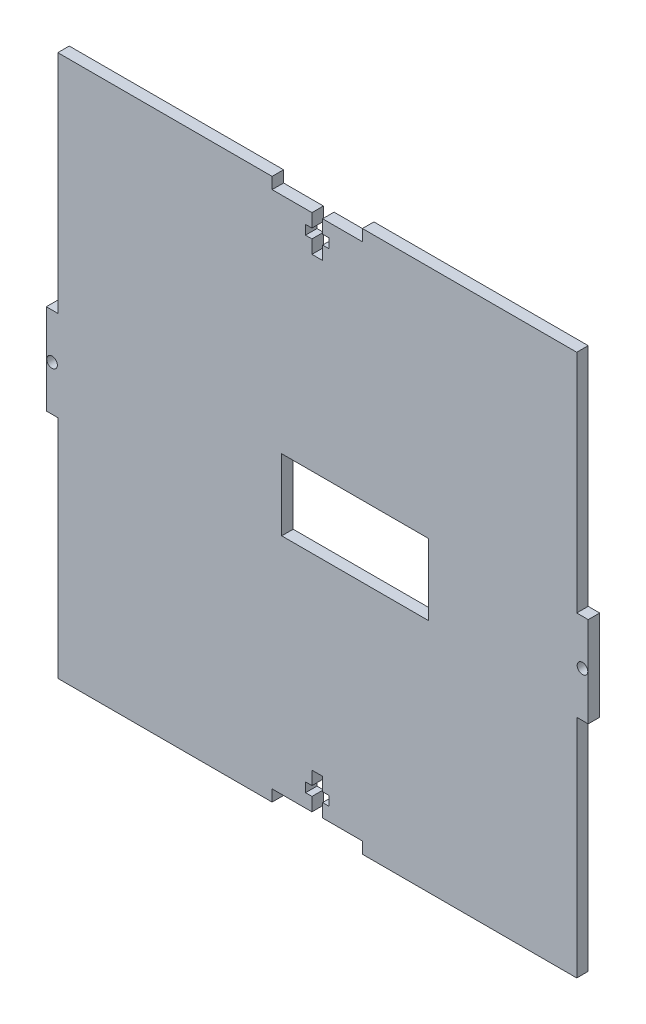
from build123d import *

# Parameters (mm, degrees)
SKETCH1_R           = 1.47
BOSS_EXTRUDE1_DEPTH = 1.5875
SKETCH2_W           = 40.7
SKETCH2_H           = 19.685
CUT_EXTRUDE1_DEPTH  = 107.113527059


with BuildPart() as part:
    # Sketch1 → Boss-Extrude1 (new, symmetric)
    with BuildSketch(Plane.XY):
        Polygon((-12.5, 75), (-71.825, 75), (-71.825, 12.5), (-75, 12.5), (-75, -12.5), (-71.825, -12.5), (-71.825, -75), (-12.5, -75), (-12.5, -71.825), (-1.47, -71.825), (-1.47, -68.125), (-3.25, -68.125), (-3.25, -65.525), (-1.47, -65.525), (-1.47, -61.825), (1.47, -61.825), (1.47, -65.525), (3.25, -65.525), (3.25, -68.125), (1.47, -68.125), (1.47, -71.825), (12.5, -71.825), (12.5, -75), (71.825, -75), (71.825, -12.5), (75, -12.5), (75, 12.5), (71.825, 12.5), (71.825, 75), (12.5, 75), (12.5, 71.825), (1.47, 71.825), (1.47, 68.125), (3.25, 68.125), (3.25, 65.525), (1.47, 65.525), (1.47, 61.825), (-1.47, 61.825), (-1.47, 65.525), (-3.25, 65.525), (-3.25, 68.125), (-1.47, 68.125), (-1.47, 71.825), (-12.5, 71.825), align=None)
        with Locations((-73.4125, 0)):
            Circle(SKETCH1_R, mode=Mode.SUBTRACT)
        with Locations(Location((73.4125, 0, 0), (0, 0, 180))):
            Circle(SKETCH1_R, mode=Mode.SUBTRACT)
    extrude(amount=BOSS_EXTRUDE1_DEPTH, both=True)

    # Sketch2 → Cut-Extrude1 (cut, through all)
    with BuildSketch(Plane.XY.offset(1.5875)):
        with Locations((10.5075, 0)):
            Rectangle(SKETCH2_W, SKETCH2_H)
    extrude(amount=-CUT_EXTRUDE1_DEPTH, mode=Mode.SUBTRACT)


solid = part.part
